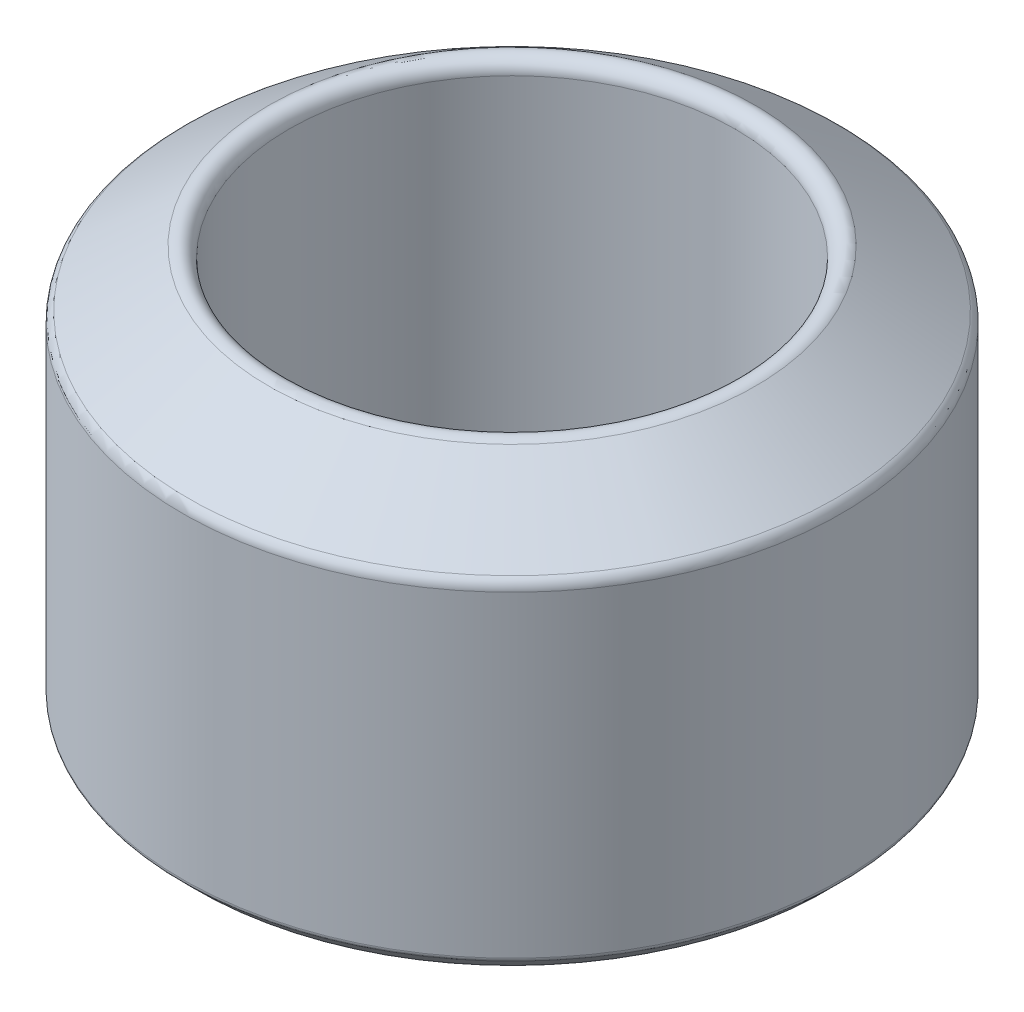
from build123d import *


with BuildPart() as part:
    # Main Revolve Sketch → Main Revolve (revolve)
    with BuildSketch(Plane.XY):
        with BuildLine():
            Line((-4.35, 0.691421356), (-4.35, 7.62268511))
            ThreePointArc((-4.35, 7.62268511), (-4.484562847, 7.844437818), (-4.743394109, 7.827473121))
            Line((-4.743394109, 7.827473121), (-6.318394109, 6.724646248))
            ThreePointArc((-6.318394109, 6.724646248), (-6.396752708, 6.635295391), (-6.425, 6.519858237))
            Line((-6.425, 6.519858237), (-6.425, 0.341421356))
            ThreePointArc((-6.425, 0.341421356), (-6.417387953, 0.303153013), (-6.395710678, 0.270710678))
            Line((-6.395710678, 0.270710678), (-6.154289322, 0.029289322))
            ThreePointArc((-6.154289322, 0.029289322), (-6.121846987, 0.007612047), (-6.083578644, 0))
            Line((-6.083578644, 0), (-5.041421356, 0))
            ThreePointArc((-5.041421356, 0), (-5.003153013, 0.007612047), (-4.970710678, 0.029289322))
            Line((-4.970710678, 0.029289322), (-4.379289322, 0.620710678))
            ThreePointArc((-4.379289322, 0.620710678), (-4.357612047, 0.653153013), (-4.35, 0.691421356))
        make_face()
    revolve(axis=Axis((0, 79.304695449, 0), (0, -1, 0)))


solid = part.part
